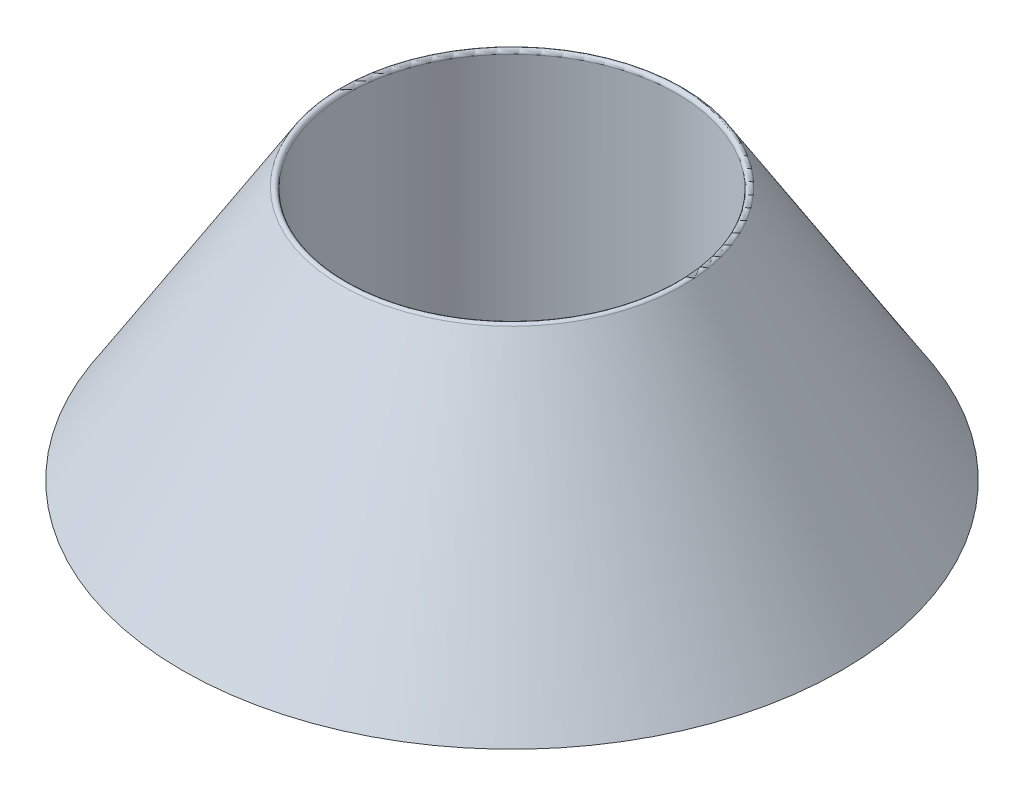
from build123d import *

# Parameters (mm, degrees)
FILLET1_R = 0.05


with BuildPart() as part:
    # Sketch2 → Revolve1 (revolve)
    with BuildSketch(Plane.XY, mode=Mode.PRIVATE) as revolve1_sk:
        Polygon((2.5, 4), (2.5, 0), (5, 0), align=None)
    revolve(revolve1_sk.sketch.rotate(Axis((0, 0, 0), (0, 1, 0)), 90), axis=Axis((0, 0, 0), (0, 1, 0)))

    # Fillet1
    fillet1_edges = [part.edges().sort_by_distance(p)[0] for p in [
        (0, 4, 2.5),
    ]]
    fillet(fillet1_edges, radius=FILLET1_R)


solid = part.part
